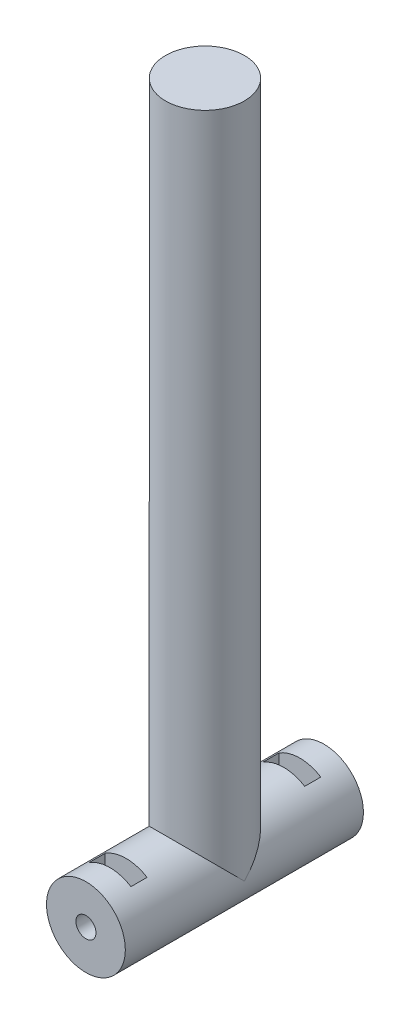
from build123d import *

# Parameters (mm, degrees)
BOSS_EXTRUDE1_DEPTH      = 14.8
BOSS_EXTRUDE1_DEPTH_BACK = 14.8
SKETCH1_R                = 4.9
SKETCH2_R                = 4.9
BOSS_EXTRUDE2_DEPTH      = 84
CUT_EXTRUDE1_DEPTH       = 2
SKETCH5_W                = 5.196152422
SKETCH5_H                = 2
CUT_EXTRUDE2_DEPTH       = 12
SKETCH6_R                = 1.25
CUT_EXTRUDE3_DEPTH       = 10


with BuildPart() as part:
    # Sketch1 → Boss-Extrude1 (new, two sides: drawn at the far end of the back side and taken through both)
    with BuildSketch(Plane.XY.offset(-BOSS_EXTRUDE1_DEPTH_BACK)):
        Circle(SKETCH1_R)
    extrude(amount=BOSS_EXTRUDE1_DEPTH + BOSS_EXTRUDE1_DEPTH_BACK)

    # Sketch2 → Boss-Extrude2 (add)
    with BuildSketch(Plane(origin=(0, 0, 0), x_dir=(1, 0, 0), z_dir=(0, 1, 0))):
        Circle(SKETCH2_R)
    extrude(amount=BOSS_EXTRUDE2_DEPTH)

    # Sketch4 → Cut-Extrude1 (cut)
    with BuildSketch(Plane.XY.offset(11.8)):
        Polygon((2.598076211, 0), (1.299038106, 2.25), (-1.299038106, 2.25), (-2.598076211, 0), (-1.299038106, -2.25), (1.299038106, -2.25), align=None)
    cut_extrude1 = extrude(amount=-CUT_EXTRUDE1_DEPTH, mode=Mode.SUBTRACT)

    # Sketch5 → Cut-Extrude2 (cut)
    with BuildSketch(Plane(origin=(0, 0, 0), x_dir=(1, 0, 0), z_dir=(0, 1, 0))):
        with Locations((0, -10.8)):
            Rectangle(SKETCH5_W, SKETCH5_H)
    cut_extrude2 = extrude(amount=CUT_EXTRUDE2_DEPTH, mode=Mode.SUBTRACT)

    # Mirror2: Cut-Extrude1, Cut-Extrude2 across plane
    add(cut_extrude1.mirror(Plane.XY), mode=Mode.SUBTRACT)
    add(cut_extrude2.mirror(Plane.XY), mode=Mode.SUBTRACT)

    # Sketch6 → Cut-Extrude3 (cut)
    with BuildSketch(Plane(origin=(0, 0, -14.8), x_dir=(-1, 0, 0), z_dir=(0, 0, -1))):
        Circle(SKETCH6_R)
    cut_extrude3 = extrude(amount=-CUT_EXTRUDE3_DEPTH, mode=Mode.SUBTRACT)

    # Mirror3: Cut-Extrude3 across plane
    add(cut_extrude3.mirror(Plane.XY), mode=Mode.SUBTRACT)


solid = part.part
